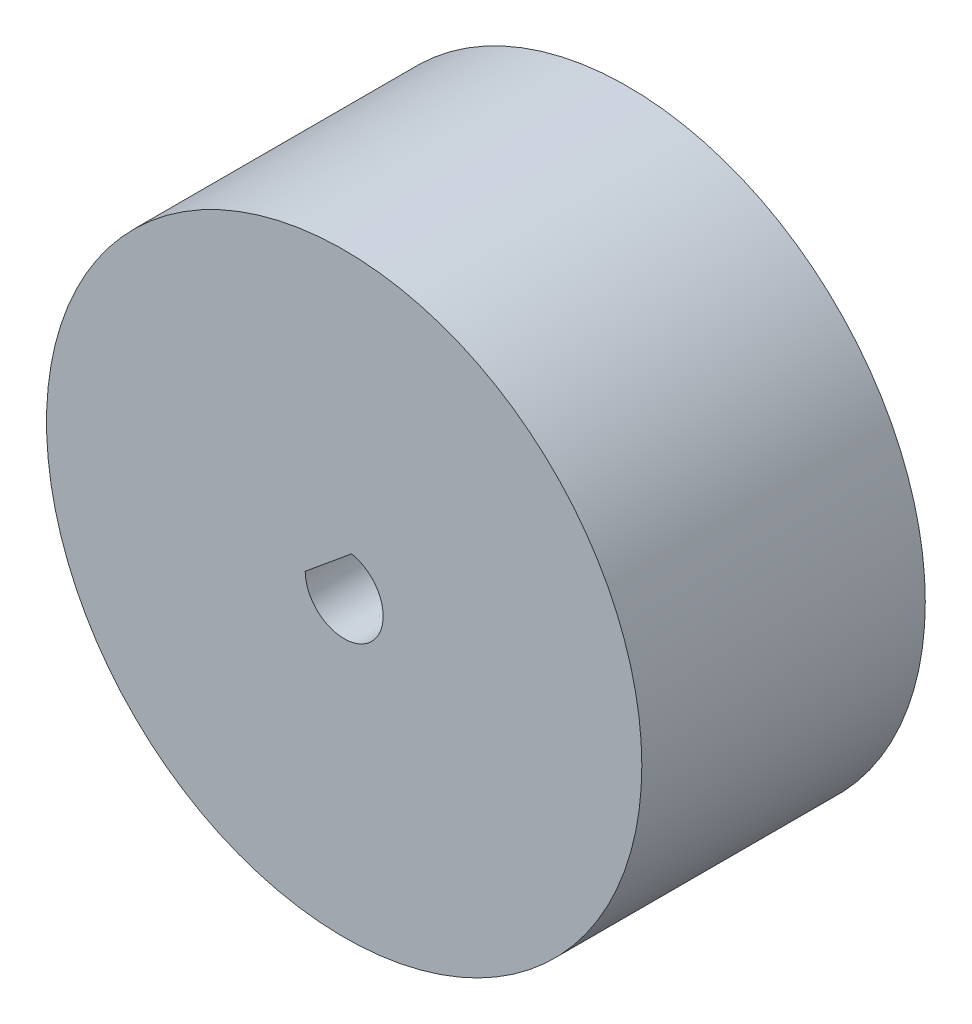
from build123d import *

# Parameters (mm, degrees)
SKETCH1_R           = 21
BOSS_EXTRUDE1_DEPTH = 20
CUT_EXTRUDE1_DEPTH  = 17
CUT_EXTRUDE2_START  = -3
SKETCH3_R           = 4.25
CUT_EXTRUDE2_DEPTH  = 18


with BuildPart() as part:
    # Sketch1 → Boss-Extrude1 (new body)
    with BuildSketch(Plane.XY):
        Circle(SKETCH1_R)
    extrude(amount=BOSS_EXTRUDE1_DEPTH)

    # Sketch2 → Cut-Extrude1 (cut)
    with BuildSketch(Plane.XY.offset(20)):
        with BuildLine():
            Line((-2.75, 0), (0.522727273, 2.699862255))
            ThreePointArc((0.522727273, 2.699862255), (1.75, -2.121320344), (-2.75, 0))
        make_face()
    extrude(amount=-CUT_EXTRUDE1_DEPTH, mode=Mode.SUBTRACT)

    # Sketch3 → Cut-Extrude2 (cut)
    with BuildSketch(Plane.XY.offset(20).offset(CUT_EXTRUDE2_START)):
        with Locations((0, 11.75)):
            Circle(SKETCH3_R)
    extrude(amount=-CUT_EXTRUDE2_DEPTH, mode=Mode.SUBTRACT)


solid = part.part
